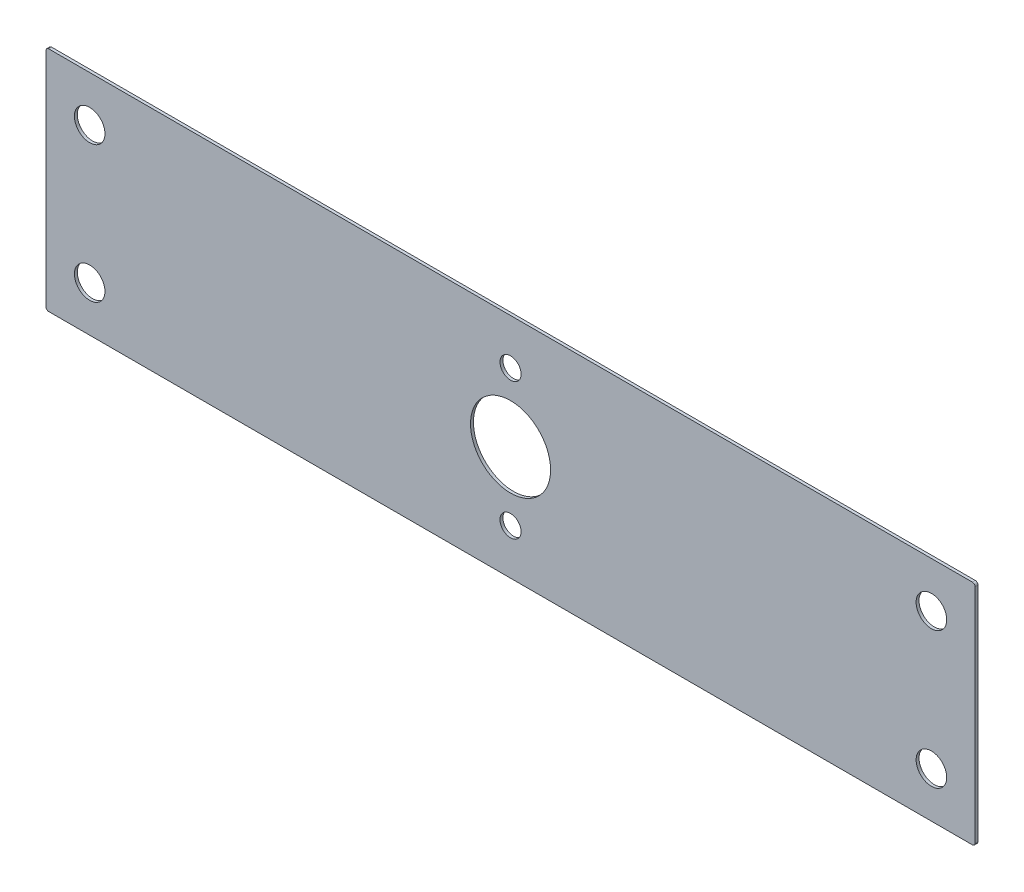
from build123d import *

# Parameters (mm, degrees)
SKETCH1_W           = 129.6416
SKETCH1_H           = 31.75
SKETCH1_R           = 2.1336
SKETCH1_R_2         = 5.588
SKETCH1_R_3         = 1.4732
BOSS_EXTRUDE1_DEPTH = 0.4064
FILLET1_R           = 0.381


with BuildPart() as part:
    # Sketch1 → Boss-Extrude1 (new body)
    with BuildSketch(Plane.XY):
        Rectangle(SKETCH1_W, SKETCH1_H)
        with Locations((58.7248, 9.525)):
            Circle(SKETCH1_R, mode=Mode.SUBTRACT)
        with Locations((58.7248, -9.525)):
            Circle(SKETCH1_R, mode=Mode.SUBTRACT)
        Circle(SKETCH1_R_2, mode=Mode.SUBTRACT)
        with Locations((0, 9.525)):
            Circle(SKETCH1_R_3, mode=Mode.SUBTRACT)
        with Locations((0, -9.525)):
            Circle(SKETCH1_R_3, mode=Mode.SUBTRACT)
        with Locations((-58.7248, 9.525)):
            Circle(SKETCH1_R, mode=Mode.SUBTRACT)
        with Locations((-58.7248, -9.525)):
            Circle(SKETCH1_R, mode=Mode.SUBTRACT)
    extrude(amount=BOSS_EXTRUDE1_DEPTH)

    # Fillet1
    fillet1_edges = [part.edges().sort_by_distance(p)[0] for p in [
        (-64.8208, 15.875, 0.2032),
        (-64.8208, -15.875, 0.2032),
        (64.8208, -15.875, 0.2032),
        (64.8208, 15.875, 0.2032),
    ]]
    fillet(fillet1_edges, radius=FILLET1_R)


solid = part.part
